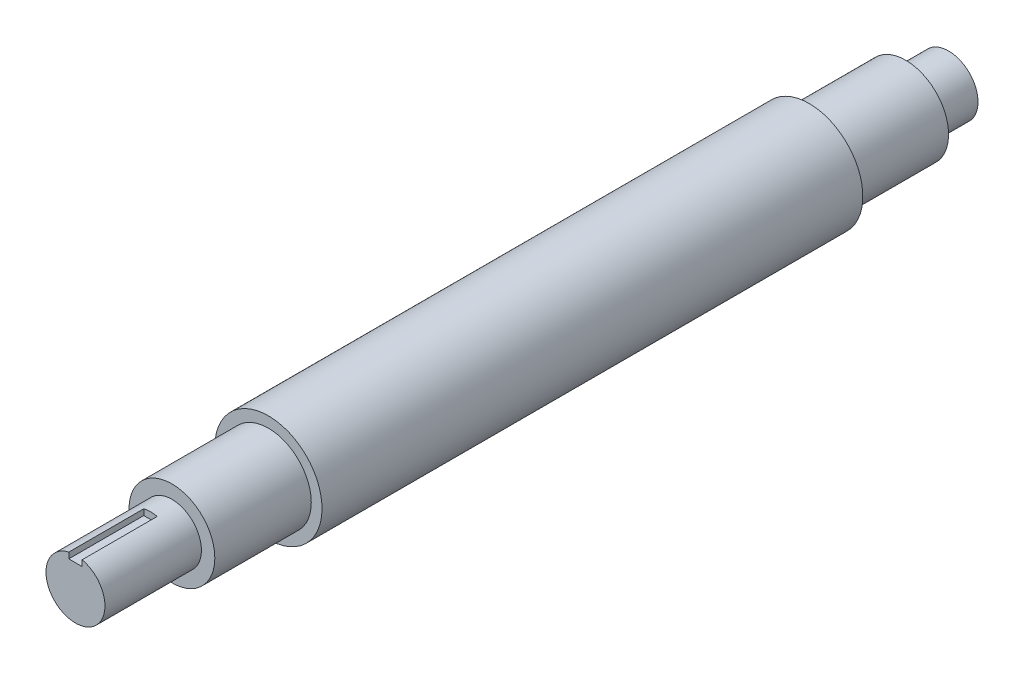
from build123d import *

# Parameters (mm, degrees)
SKETCH1_R           = 31.75
BOSS_EXTRUDE1_DEPTH = 160.1978
SKETCH2_R           = 25.4
BOSS_EXTRUDE2_DEPTH = 57.15
BOSS_EXTRUDE3_START = 57.15
SKETCH3_R           = 25.4
BOSS_EXTRUDE3_DEPTH = 57.15
SKETCH5_R           = 17.4625
BOSS_EXTRUDE5_DEPTH = 25.4
BOSS_EXTRUDE6_START = 57.15
SKETCH18_R          = 17.4625
BOSS_EXTRUDE6_DEPTH = 57.15
SKETCH20_W          = 7.9248
SKETCH20_H          = 7.9248
CUT_EXTRUDE1_DEPTH  = 44.45


with BuildPart() as part:
    # Sketch1 → Boss-Extrude1 (new, symmetric)
    with BuildSketch(Plane.XY):
        with Locations(Location((0, 0, 0), (0, 0, 180))):
            Circle(SKETCH1_R)
    extrude(amount=BOSS_EXTRUDE1_DEPTH, both=True)

    # Sketch2 → Boss-Extrude2 (add)
    with BuildSketch(Plane.XY.offset(160.1978)):
        Circle(SKETCH2_R)
    extrude(amount=BOSS_EXTRUDE2_DEPTH)

    # Sketch3 → Boss-Extrude3 (add)
    with BuildSketch(Plane(origin=(0, 0, -160.1978), x_dir=(-1, 0, 0), z_dir=(0, 0, -1)).offset(BOSS_EXTRUDE3_START)):
        with Locations(Location((0, 0, 0), (0, 0, 180))):
            Circle(SKETCH3_R)
    extrude(amount=-BOSS_EXTRUDE3_DEPTH)

    # Sketch5 → Boss-Extrude5 (add)
    with BuildSketch(Plane(origin=(0, 0, -217.3478), x_dir=(-1, 0, 0), z_dir=(0, 0, -1))):
        Circle(SKETCH5_R)
    extrude(amount=BOSS_EXTRUDE5_DEPTH)

    # Sketch18 → Boss-Extrude6 (add)
    with BuildSketch(Plane.XY.offset(217.3478).offset(BOSS_EXTRUDE6_START)):
        with Locations(Location((0, 0, 0), (0, 0, 180))):
            Circle(SKETCH18_R)
    extrude(amount=-BOSS_EXTRUDE6_DEPTH)

    # Sketch20 → Cut-Extrude1 (cut)
    with BuildSketch(Plane.XY.offset(274.4978)):
        with Locations((0, 17.4625)):
            Rectangle(SKETCH20_W, SKETCH20_H)
    extrude(amount=-CUT_EXTRUDE1_DEPTH, mode=Mode.SUBTRACT)


solid = part.part
